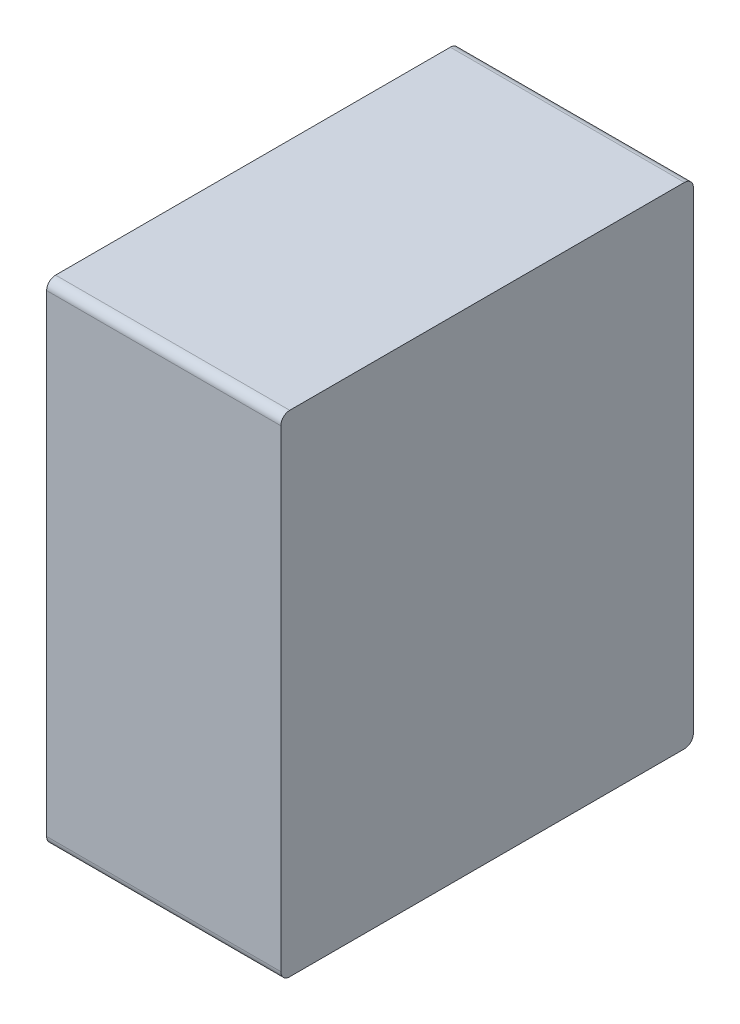
from build123d import *

# Parameters (mm, degrees)
SKETCH_1_W      = 185
SKETCH_1_H      = 220
EXTRUDE_1_DEPTH = 105
FILLET_1_R      = 4


with BuildPart() as part:
    # 草图1 → 凸台-拉伸1 (new body)
    with BuildSketch(Plane(origin=(0, 0, 0), x_dir=(0, 0, -1), z_dir=(1, 0, 0))):
        with Locations((92.5, -110)):
            Rectangle(SKETCH_1_W, SKETCH_1_H)
    extrude(amount=EXTRUDE_1_DEPTH)

    # 圆角1
    fillet_1_edges = [part.edges().sort_by_distance(p)[0] for p in [
        (52.5, 0, 0),
        (52.5, 0, -185),
        (52.5, -220, -185),
        (52.5, -220, 0),
    ]]
    fillet(fillet_1_edges, radius=FILLET_1_R)


solid = part.part
